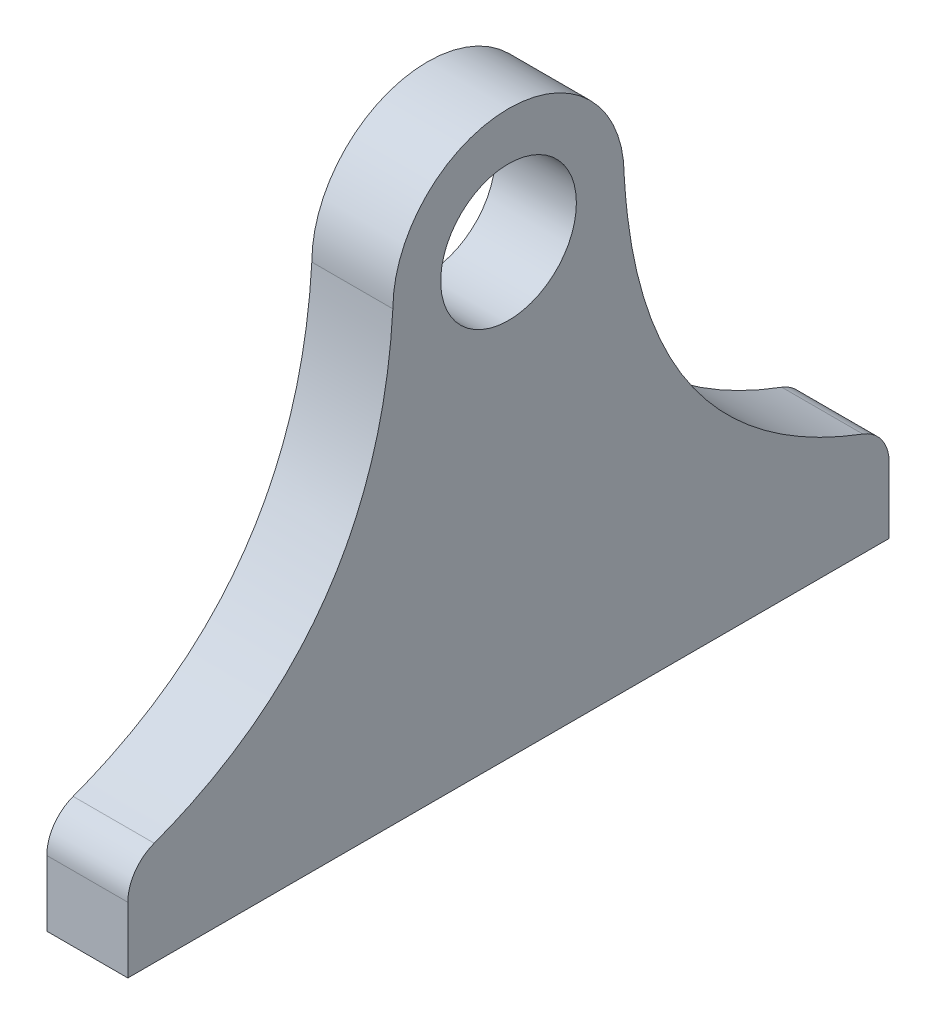
from build123d import *

# Parameters (mm, degrees)
SKETCH1_R           = 8.371232018
BOSS_EXTRUDE1_DEPTH = 10
FILLET1_R           = 5


with BuildPart() as part:
    # Sketch1 → Boss-Extrude1 (new body)
    with BuildSketch(Plane(origin=(0, 0, 0), x_dir=(0, 0, -1), z_dir=(1, 0, 0))):
        with BuildLine():
            Line((46.963546465, -11.666577207), (-46.963546465, -11.666577207))
            Line((-46.963546465, -11.666577207), (-46.963546465, 0))
            add(Edge.make_bspline(
                [(-46.963546465, 0), (-16.221096815, 9.567463223), (-14.267406521, 43.471004243)],
                knots=[0, 0, 0, 1, 1, 1], degree=2))
            ThreePointArc((-14.267406521, 43.471004243), (0, 57.738410764), (14.267406521, 43.471004243))
            add(Edge.make_bspline(
                [(46.963546465, 0), (16.221096815, 9.567463223), (14.267406521, 43.471004243)],
                knots=[0, 0, 0, 1, 1, 1], degree=2))
            Line((46.963546465, 0), (46.963546465, -11.666577207))
        make_face()
        with Locations((0, 43.471004243)):
            Circle(SKETCH1_R, mode=Mode.SUBTRACT)
    extrude(amount=BOSS_EXTRUDE1_DEPTH)

    # Fillet1
    fillet1_edges = [part.edges().sort_by_distance(p)[0] for p in [
        (5, 0, 46.963546465),
        (5, 0, -46.963546465),
    ]]
    fillet(fillet1_edges, radius=FILLET1_R)


solid = part.part
